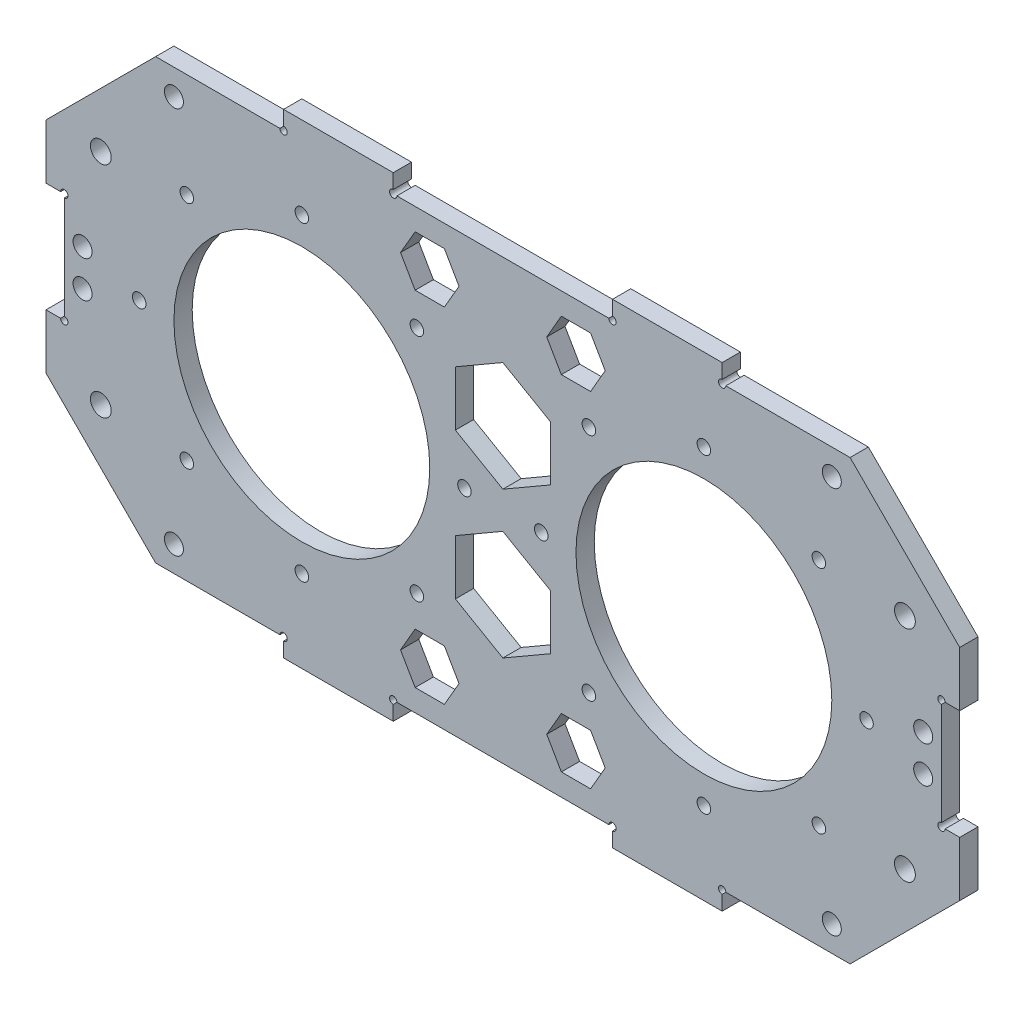
from build123d import *

# Parameters (mm, degrees)
SKETCH_1_W          = 250
SKETCH_1_H          = 120
SKETCH_1_R          = 35
EXTRUDE_1_DEPTH     = 5
SKETCH_2_R          = 1.85
CUT_EXTRUDE_1_DEPTH = 10
CUT_EXTRUDE_2_DEPTH = 10
CUT_EXTRUDE_3_DEPTH = 10
SKETCH_7_W          = 30
SKETCH_7_H          = 5
EXTRUDE_2_DEPTH     = 5
SKETCH_8_R          = 1
CUT_EXTRUDE_4_DEPTH = 10
SKETCH_9_R          = 1
SKETCH_9_W          = 5
SKETCH_9_H          = 30
CUT_EXTRUDE_5_DEPTH = 5
SKETCH_10_R         = 2.6
SKETCH_10_R_2       = 2.85
CUT_EXTRUDE_6_DEPTH = 280.55321497


with BuildPart() as part:
    # 草图1 → 凸台-拉伸1 (new body)
    with BuildSketch(Plane.XY):
        with Locations((125, 60)):
            Rectangle(SKETCH_1_W, SKETCH_1_H)
        with Locations((70, 60)):
            Circle(SKETCH_1_R, mode=Mode.SUBTRACT)
        with Locations((180, 60)):
            Circle(SKETCH_1_R, mode=Mode.SUBTRACT)
    extrude(amount=EXTRUDE_1_DEPTH)

    # 草图2 → 切除-拉伸1 (cut)
    with BuildSketch(Plane.XY.offset(5)):
        with Locations((70, 102.5)):
            Circle(SKETCH_2_R)
        with Locations((70, 17.5)):
            Circle(SKETCH_2_R)
        with Locations((25.5, 60)):
            Circle(SKETCH_2_R)
        with Locations((38.533748237, 91.466251763)):
            Circle(SKETCH_2_R)
        with Locations((101.466251763, 91.466251763)):
            Circle(SKETCH_2_R)
        with Locations((114.5, 60)):
            Circle(SKETCH_2_R)
        with Locations((101.466251763, 28.533748237)):
            Circle(SKETCH_2_R)
        with Locations((38.533748237, 28.533748237)):
            Circle(SKETCH_2_R)
        with Locations((180, 102.5)):
            Circle(SKETCH_2_R)
        with Locations(Location((148.533748237, 91.466251763, 0), (0, 0, 180))):
            Circle(SKETCH_2_R)
        with Locations((135.5, 60)):
            Circle(SKETCH_2_R)
        with Locations((148.533748237, 28.533748237)):
            Circle(SKETCH_2_R)
        with Locations(Location((180, 17.5, 0), (0, 0, 180))):
            Circle(SKETCH_2_R)
        with Locations((211.466251763, 28.533748237)):
            Circle(SKETCH_2_R)
        with Locations((224.5, 60)):
            Circle(SKETCH_2_R)
        with Locations((211.466251763, 91.466251763)):
            Circle(SKETCH_2_R)
    extrude(amount=-CUT_EXTRUDE_1_DEPTH, mode=Mode.SUBTRACT)

    # 草图3 → 切除-拉伸2 (cut)
    with BuildSketch(Plane.XY.offset(5)):
        Polygon((0, 90), (30, 120), (0, 120), align=None)
        Polygon((30, 0), (0, 30), (0, 0), align=None)
        Polygon((250, 30), (220, 0), (250, 0), align=None)
        Polygon((250, 120), (220, 120), (250, 90), align=None)
    extrude(amount=-CUT_EXTRUDE_2_DEPTH, mode=Mode.SUBTRACT)

    # 草图4 → 切除-拉伸3 (cut)
    with BuildSketch(Plane(origin=(0, 0, 0), x_dir=(-1, 0, 0), z_dir=(0, 0, -1))):
        Polygon((-125, 65), (-112.009618943, 72.5), (-112.009618943, 87.5), (-125, 95), (-137.990381057, 87.5), (-137.990381057, 72.5), align=None)
        Polygon((-109, 100.143593539), (-113, 107.07179677), (-109, 114), (-101, 114), (-97, 107.07179677), (-101, 100.143593539), align=None)
        Polygon((-137, 107.07179677), (-141, 114), (-149, 114), (-153, 107.07179677), (-149, 100.143593539), (-141, 100.143593539), align=None)
        Polygon((-137.990381057, 47.5), (-125, 55), (-112.009618943, 47.5), (-112.009618943, 32.5), (-125, 25), (-137.990381057, 32.5), align=None)
        Polygon((-101, 19.856406461), (-109, 19.856406461), (-113, 12.92820323), (-109, 6), (-101, 6), (-97, 12.92820323), align=None)
        Polygon((-141, 19.856406461), (-137, 12.92820323), (-141, 6), (-149, 6), (-153, 12.92820323), (-149, 19.856406461), align=None)
    extrude(amount=-CUT_EXTRUDE_3_DEPTH, mode=Mode.SUBTRACT)

    # 草图7 → 凸台-拉伸2 (add)
    with BuildSketch(Plane.XY.offset(5)):
        with Locations((80, 122.5)):
            Rectangle(SKETCH_7_W, SKETCH_7_H)
        with Locations((170, 122.5)):
            Rectangle(SKETCH_7_W, SKETCH_7_H)
        with Locations((80, -2.5)):
            Rectangle(SKETCH_7_W, SKETCH_7_H)
        with Locations((170, -2.5)):
            Rectangle(SKETCH_7_W, SKETCH_7_H)
    extrude(amount=-EXTRUDE_2_DEPTH)

    # 草图8 → 切除-拉伸4 (cut)
    with BuildSketch(Plane.XY.offset(5)):
        with BuildLine():
            ThreePointArc((95, -1), (95.707106781, -0.707106781), (96, 0))
            Line((96, 0), (95, 0))
            Line((95, 0), (95, -1))
        make_face()
        with BuildLine():
            Line((95, 0), (96, 0))
            ThreePointArc((96, 0), (94.292893219, 0.707106781), (95, -1))
            Line((95, -1), (95, 0))
        make_face()
        with BuildLine():
            ThreePointArc((154, 0), (154.292893219, -0.707106781), (155, -1))
            Line((155, -1), (155, 0))
            Line((155, 0), (154, 0))
        make_face()
        with BuildLine():
            Line((155, 0), (155, -1))
            ThreePointArc((155, -1), (155.707106781, -0.707106781), (156, 0))
            ThreePointArc((156, 0), (155, 1), (154, 0))
            Line((154, 0), (155, 0))
        make_face()
        with BuildLine():
            ThreePointArc((185, -1), (185.707106781, -0.707106781), (186, 0))
            Line((186, 0), (185, 0))
            Line((185, 0), (185, -1))
        make_face()
        with BuildLine():
            Line((185, 0), (186, 0))
            ThreePointArc((186, 0), (184.292893219, 0.707106781), (185, -1))
            Line((185, -1), (185, 0))
        make_face()
        with BuildLine():
            ThreePointArc((156, 120), (155.707106781, 120.707106781), (155, 121))
            Line((155, 121), (155, 120))
            Line((155, 120), (154, 120))
            ThreePointArc((154, 120), (155, 119), (156, 120))
        make_face()
        with BuildLine():
            Line((155, 120), (155, 121))
            ThreePointArc((155, 121), (154.292893219, 120.707106781), (154, 120))
            Line((154, 120), (155, 120))
        make_face()
        with BuildLine():
            ThreePointArc((185, 121), (184.292893219, 119.292893219), (186, 120))
            Line((186, 120), (185, 120))
            Line((185, 120), (185, 121))
        make_face()
        with BuildLine():
            Line((185, 120), (186, 120))
            ThreePointArc((186, 120), (185.707106781, 120.707106781), (185, 121))
            Line((185, 121), (185, 120))
        make_face()
        with BuildLine():
            ThreePointArc((66, 120), (65.707106781, 120.707106781), (65, 121))
            Line((65, 121), (65, 120))
            Line((65, 120), (64, 120))
            ThreePointArc((64, 120), (65, 119), (66, 120))
        make_face()
        with BuildLine():
            Line((65, 120), (65, 121))
            ThreePointArc((65, 121), (64.292893219, 120.707106781), (64, 120))
            Line((64, 120), (65, 120))
        make_face()
        with BuildLine():
            ThreePointArc((95, 121), (94.292893219, 119.292893219), (96, 120))
            Line((96, 120), (95, 120))
            Line((95, 120), (95, 121))
        make_face()
        with BuildLine():
            Line((95, 120), (96, 120))
            ThreePointArc((96, 120), (95.707106781, 120.707106781), (95, 121))
            Line((95, 121), (95, 120))
        make_face()
        with Locations((65, 0)):
            Circle(SKETCH_8_R)
    extrude(amount=-CUT_EXTRUDE_4_DEPTH, mode=Mode.SUBTRACT)

    # 草图9 → 切除-拉伸5 (cut)
    with BuildSketch(Plane.XY.offset(5)):
        with Locations((5, 45)):
            Circle(SKETCH_9_R)
        with Locations((5, 75)):
            Circle(SKETCH_9_R)
        with Locations((2.5, 60)):
            Rectangle(SKETCH_9_W, SKETCH_9_H)
        with BuildLine():
            ThreePointArc((6, 75), (5, 76), (4, 75))
            Line((4, 75), (5, 75))
            Line((5, 75), (5, 74))
            ThreePointArc((5, 74), (5.707106781, 74.292893219), (6, 75))
        make_face()
        with BuildLine():
            Line((5, 75), (4, 75))
            ThreePointArc((4, 75), (4.292893219, 74.292893219), (5, 74))
            Line((5, 74), (5, 75))
        make_face()
        with BuildLine():
            ThreePointArc((6, 75), (5, 76), (4, 75))
            Line((4, 75), (5, 75))
            Line((5, 75), (5, 74))
            ThreePointArc((5, 74), (5.707106781, 74.292893219), (6, 75))
        make_face()
        with BuildLine():
            Line((5, 75), (4, 75))
            ThreePointArc((4, 75), (4.292893219, 74.292893219), (5, 74))
            Line((5, 74), (5, 75))
        make_face()
        with BuildLine():
            ThreePointArc((5, 46), (4.292893219, 45.707106781), (4, 45))
            Line((4, 45), (5, 45))
            Line((5, 45), (5, 46))
        make_face()
        with BuildLine():
            Line((5, 45), (4, 45))
            ThreePointArc((4, 45), (5, 44), (6, 45))
            ThreePointArc((6, 45), (5.707106781, 45.707106781), (5, 46))
            Line((5, 46), (5, 45))
        make_face()
        with BuildLine():
            ThreePointArc((5, 46), (4.292893219, 45.707106781), (4, 45))
            Line((4, 45), (5, 45))
            Line((5, 45), (5, 46))
        make_face()
        with BuildLine():
            Line((5, 45), (4, 45))
            ThreePointArc((4, 45), (5, 44), (6, 45))
            ThreePointArc((6, 45), (5.707106781, 45.707106781), (5, 46))
            Line((5, 46), (5, 45))
        make_face()
        with BuildLine():
            ThreePointArc((245, 74), (245.707106781, 74.292893219), (246, 75))
            Line((246, 75), (245, 75))
            Line((245, 75), (245, 74))
        make_face()
        with BuildLine():
            Line((245, 75), (246, 75))
            ThreePointArc((246, 75), (244.292893219, 75.707106781), (245, 74))
            Line((245, 74), (245, 75))
        make_face()
        with Locations((245, 45)):
            Circle(SKETCH_9_R)
        with Locations((245, 75)):
            Circle(SKETCH_9_R)
        with Locations((247.5, 60)):
            Rectangle(SKETCH_9_W, SKETCH_9_H)
        with BuildLine():
            ThreePointArc((245, 74), (245.707106781, 74.292893219), (246, 75))
            Line((246, 75), (245, 75))
            Line((245, 75), (245, 74))
        make_face()
        with BuildLine():
            Line((245, 75), (246, 75))
            ThreePointArc((246, 75), (244.292893219, 75.707106781), (245, 74))
            Line((245, 74), (245, 75))
        make_face()
        with BuildLine():
            ThreePointArc((245, 46), (244.292893219, 44.292893219), (246, 45))
            Line((246, 45), (245, 45))
            Line((245, 45), (245, 46))
        make_face()
        with BuildLine():
            Line((245, 45), (246, 45))
            ThreePointArc((246, 45), (245.707106781, 45.707106781), (245, 46))
            Line((245, 46), (245, 45))
        make_face()
        with BuildLine():
            ThreePointArc((245, 46), (244.292893219, 44.292893219), (246, 45))
            Line((246, 45), (245, 45))
            Line((245, 45), (245, 46))
        make_face()
        with BuildLine():
            Line((245, 45), (246, 45))
            ThreePointArc((246, 45), (245.707106781, 45.707106781), (245, 46))
            Line((245, 46), (245, 45))
        make_face()
    extrude(amount=-CUT_EXTRUDE_5_DEPTH, mode=Mode.SUBTRACT)

    # 草图10 → 切除-拉伸6 (cut, through all)
    with BuildSketch(Plane.XY.offset(5)):
        with Locations((10, 55)):
            Circle(SKETCH_10_R)
        with Locations((15, 30)):
            Circle(SKETCH_10_R_2)
        with Locations((35, 7)):
            Circle(SKETCH_10_R)
        with Locations((215, 7)):
            Circle(SKETCH_10_R)
        with Locations((235, 30)):
            Circle(SKETCH_10_R_2)
        with Locations((240, 55)):
            Circle(SKETCH_10_R)
        with Locations(Location((10, 65, 0), (0, 0, 180))):
            Circle(SKETCH_10_R)
        with Locations(Location((15, 90, 0), (0, 0, 180))):
            Circle(SKETCH_10_R_2)
        with Locations(Location((35, 113, 0), (0, 0, 180))):
            Circle(SKETCH_10_R)
        with Locations((215, 113)):
            Circle(SKETCH_10_R)
        with Locations((235, 90)):
            Circle(SKETCH_10_R_2)
        with Locations((240, 65)):
            Circle(SKETCH_10_R)
    extrude(amount=-CUT_EXTRUDE_6_DEPTH, mode=Mode.SUBTRACT)


solid = part.part
